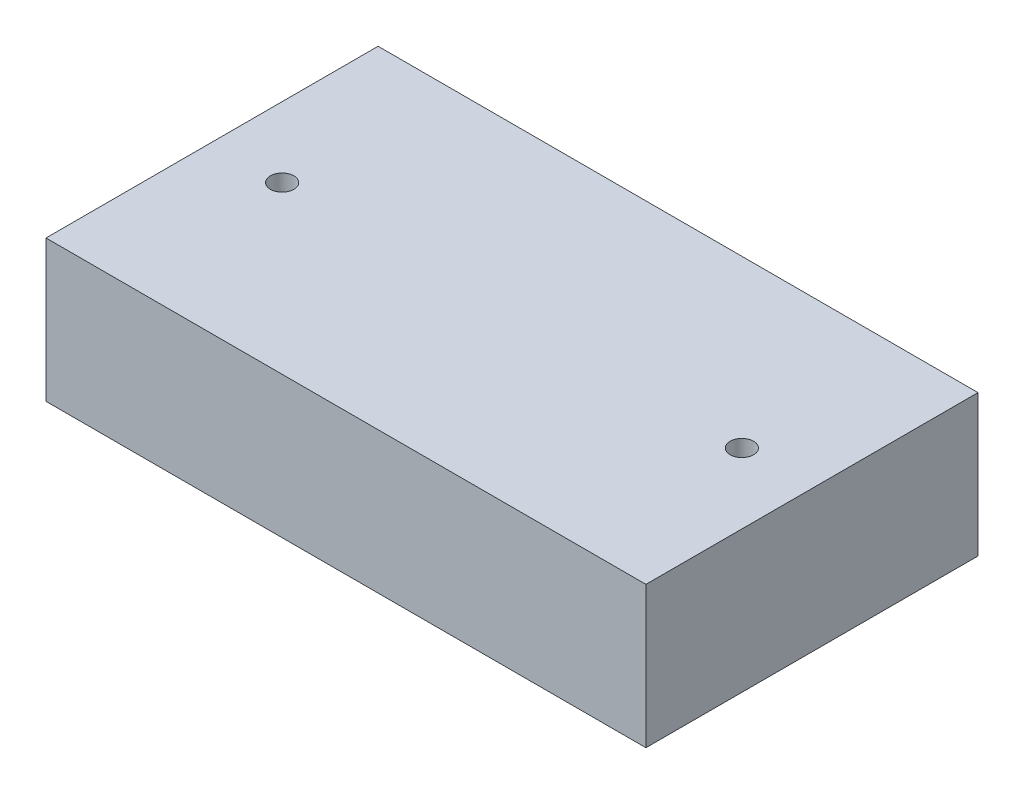
from build123d import *

# Parameters (mm, degrees)
SKETCH_1_W          = 76.6
SKETCH_1_H          = 42.4
EXTRUDE_1_DEPTH     = 18.07
SKETCH_2_R          = 1.5
CUT_EXTRUDE_1_DEPTH = 10
SKETCH_3_R          = 1.5
CUT_EXTRUDE_2_DEPTH = 10


with BuildPart() as part:
    # Эскиз1 → Бобышка-Вытянуть1 (new body)
    with BuildSketch(Plane(origin=(0, 0, 0), x_dir=(1, 0, 0), z_dir=(0, 1, 0))):
        Rectangle(SKETCH_1_W, SKETCH_1_H)
    extrude(amount=EXTRUDE_1_DEPTH)

    # Эскиз2 → Вырез-Вытянуть1 (cut)
    with BuildSketch(Plane(origin=(0, 18.07, 0), x_dir=(1, 0, 0), z_dir=(0, 1, 0))):
        with Locations(Location((29.35, 0, 0), (0, 0, 270))):
            Circle(SKETCH_2_R)
        with Locations(Location((-29.35, 0, 0), (0, 0, 90))):
            Circle(SKETCH_2_R)
    extrude(amount=-CUT_EXTRUDE_1_DEPTH, mode=Mode.SUBTRACT)

    # Эскиз3 → Вырез-Вытянуть2 (cut)
    with BuildSketch(Plane.XZ):
        with Locations(Location((20, 0, 0), (0, 0, 270))):
            Circle(SKETCH_3_R)
        with Locations(Location((-20, 0, 0), (0, 0, 90))):
            Circle(SKETCH_3_R)
    extrude(amount=-CUT_EXTRUDE_2_DEPTH, mode=Mode.SUBTRACT)


solid = part.part
